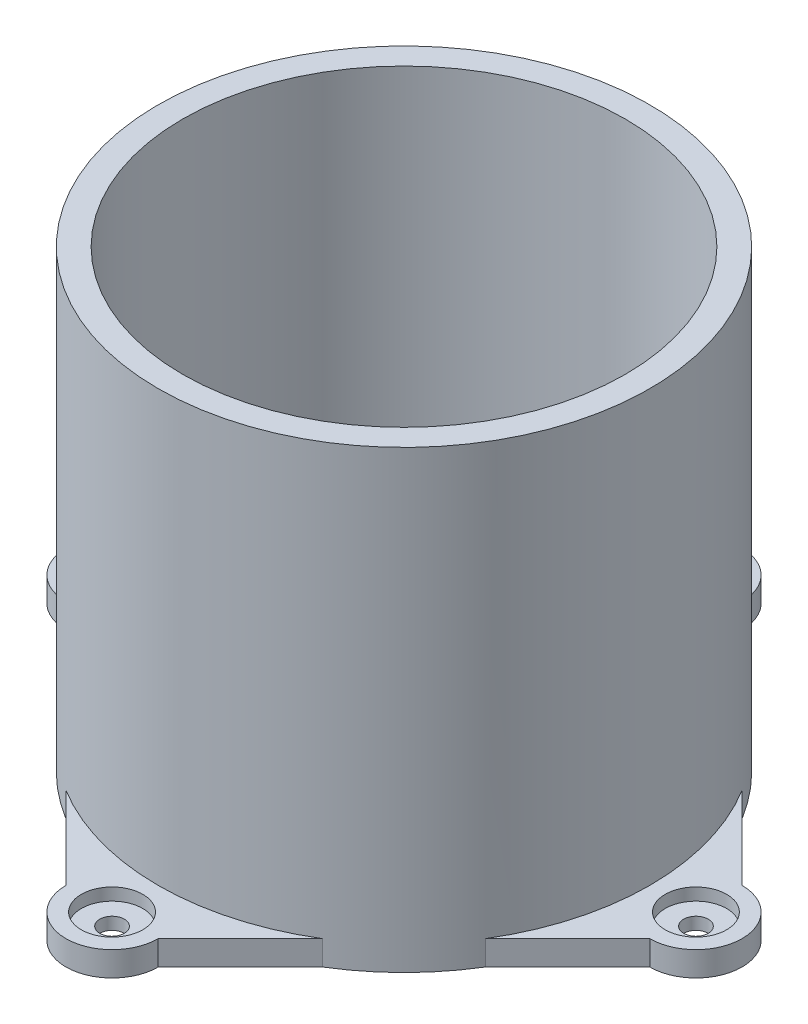
from build123d import *

# Parameters (mm, degrees)
BOSS_EXTRUDE1_DEPTH = 4
SKETCH2_R           = 2
CUT_EXTRUDE1_DEPTH  = 4
SKETCH3_R           = 5
CUT_EXTRUDE2_DEPTH  = 2
SKETCH4_R           = 40
SKETCH4_R_2         = 36
BOSS_EXTRUDE2_DEPTH = 70


with BuildPart() as part:
    # Sketch1 → Boss-Extrude1 (new body)
    with BuildSketch(Plane(origin=(0, 0, 0), x_dir=(1, 0, 0), z_dir=(0, 1, 0))):
        with BuildLine():
            Line((-47.5, 7.5), (-34.114378278, 20.885621722))
            ThreePointArc((-34.114378278, 20.885621722), (-28.284271247, 28.284271247), (-20.885621722, 34.114378278))
            Line((-20.885621722, 34.114378278), (-7.5, 47.5))
            ThreePointArc((-7.5, 47.5), (0, 55), (7.5, 47.5))
            Line((7.5, 47.5), (20.885621722, 34.114378278))
            ThreePointArc((20.885621722, 34.114378278), (28.284271247, 28.284271247), (34.114378278, 20.885621722))
            Line((34.114378278, 20.885621722), (47.5, 7.5))
            ThreePointArc((47.5, 7.5), (55, 0), (47.5, -7.5))
            Line((47.5, -7.5), (34.114378278, -20.885621722))
            ThreePointArc((34.114378278, -20.885621722), (28.284271247, -28.284271247), (20.885621722, -34.114378278))
            Line((20.885621722, -34.114378278), (7.5, -47.5))
            ThreePointArc((7.5, -47.5), (0, -55), (-7.5, -47.5))
            Line((-7.5, -47.5), (-20.885621722, -34.114378278))
            ThreePointArc((-20.885621722, -34.114378278), (-28.284271247, -28.284271247), (-34.114378278, -20.885621722))
            Line((-34.114378278, -20.885621722), (-47.5, -7.5))
            ThreePointArc((-47.5, -7.5), (-55, 0), (-47.5, 7.5))
        make_face()
    extrude(amount=BOSS_EXTRUDE1_DEPTH)

    # Sketch2 → Cut-Extrude1 (cut)
    with BuildSketch(Plane(origin=(0, 4, 0), x_dir=(1, 0, 0), z_dir=(0, 1, 0))):
        with Locations(Location((-47.5, 0, 0), (0, 0, 270))):
            Circle(SKETCH2_R)
        with Locations(Location((0, 47.5, 0), (0, 0, 270))):
            Circle(SKETCH2_R)
        with Locations(Location((47.5, 0, 0), (0, 0, 270))):
            Circle(SKETCH2_R)
        with Locations(Location((0, -47.5, 0), (0, 0, 270))):
            Circle(SKETCH2_R)
    extrude(amount=-CUT_EXTRUDE1_DEPTH, mode=Mode.SUBTRACT)

    # Sketch3 → Cut-Extrude2 (cut)
    with BuildSketch(Plane(origin=(0, 4, 0), x_dir=(1, 0, 0), z_dir=(0, 1, 0))):
        with Locations(Location((-47.5, 0, 0), (0, 0, 270))):
            Circle(SKETCH3_R)
        with Locations(Location((0, 47.5, 0), (0, 0, 270))):
            Circle(SKETCH3_R)
        with Locations(Location((47.5, 0, 0), (0, 0, 270))):
            Circle(SKETCH3_R)
        with Locations(Location((0, -47.5, 0), (0, 0, 270))):
            Circle(SKETCH3_R)
    extrude(amount=-CUT_EXTRUDE2_DEPTH, mode=Mode.SUBTRACT)

    # Sketch4 → Boss-Extrude2 (add)
    with BuildSketch(Plane(origin=(0, 4, 0), x_dir=(1, 0, 0), z_dir=(0, 1, 0))):
        with Locations(Location((0, 0, 0), (0, 0, 58.524055273))):
            Circle(SKETCH4_R)
        with Locations(Location((0, 0, 0), (0, 0, 270))):
            Circle(SKETCH4_R_2, mode=Mode.SUBTRACT)
    extrude(amount=BOSS_EXTRUDE2_DEPTH)


solid = part.part
